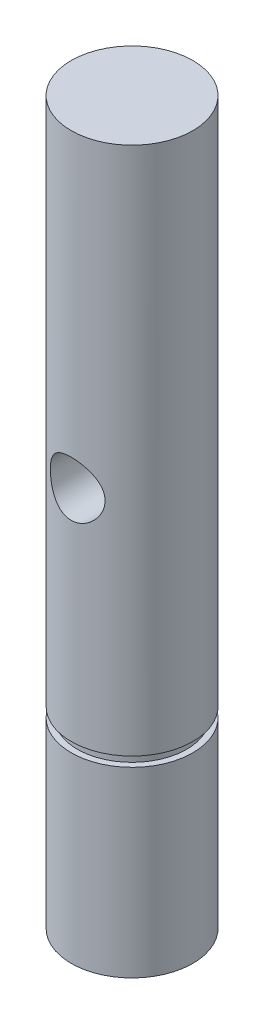
from build123d import *

# Parameters (mm, degrees)
SKETCH1_R            = 5
BOSS_EXTRUDE1_DEPTH  = 59.3
CUT_EXTRUDE1_START   = -15
SKETCH2_R            = 5
SKETCH2_R_2          = 4.5
CUT_EXTRUDE1_DEPTH   = 0.8
M4_CLEARANCE_HOLE1_D = 4.5


with BuildPart() as part:
    # Sketch1 → Boss-Extrude1 (new body)
    with BuildSketch(Plane(origin=(0, 0, 0), x_dir=(1, 0, 0), z_dir=(0, 1, 0))):
        with Locations(Location((0, 0, 0), (0, 0, 90))):
            Circle(SKETCH1_R)
    extrude(amount=BOSS_EXTRUDE1_DEPTH)

    # Sketch2 → Cut-Extrude1 (cut)
    with BuildSketch(Plane.XZ.offset(CUT_EXTRUDE1_START)):
        with Locations(Location((0, 0, 0), (0, 0, 270))):
            Circle(SKETCH2_R)
        with Locations(Location((0, 0, 0), (0, 0, 270))):
            Circle(SKETCH2_R_2, mode=Mode.SUBTRACT)
    extrude(amount=-CUT_EXTRUDE1_DEPTH, mode=Mode.SUBTRACT)

    # M4 Clearance Hole1 (through all)
    with Locations(Plane.XY.offset(5)):
        with Locations((0, 33.8)):
            Hole(M4_CLEARANCE_HOLE1_D / 2)


solid = part.part
